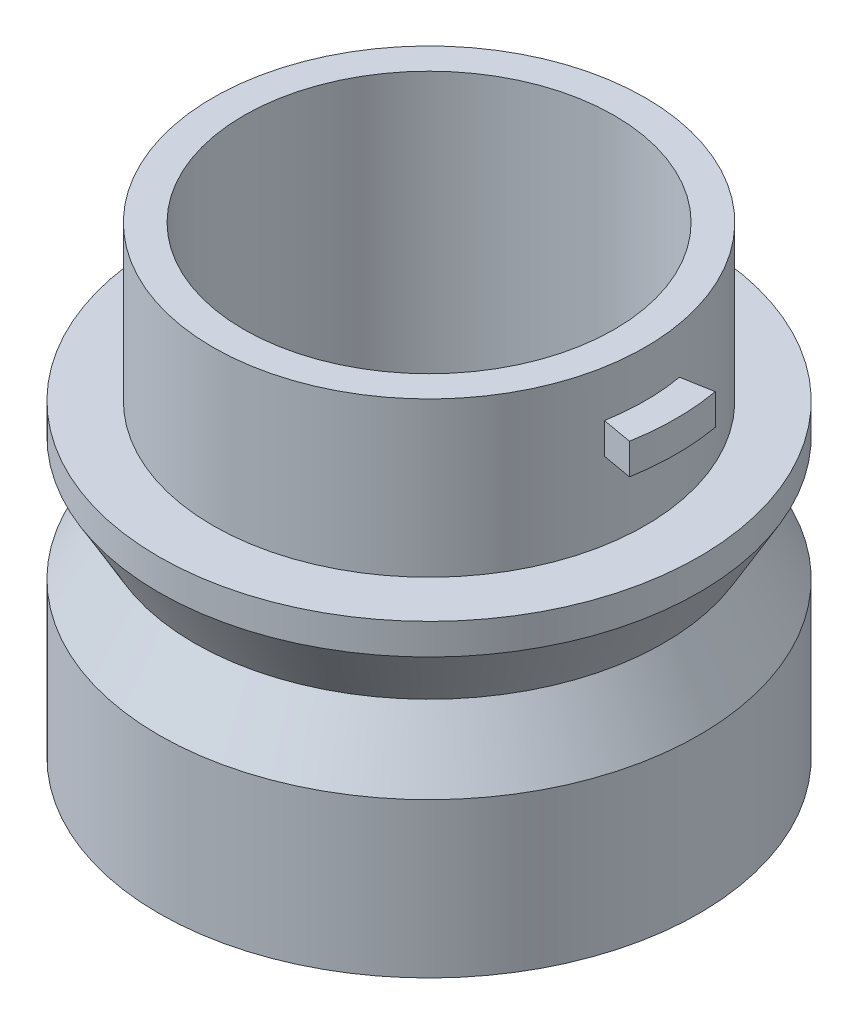
from build123d import *

# Parameters (mm, degrees)
SKETCH2_W          = 2
SKETCH2_H          = 2
REVOLVE2_ANGLE     = 20
SKETCH3_W          = 2.2
SKETCH3_H          = 6.8
CUT_REVOLVE1_ANGLE = 25
SKETCH4_W          = 4.7
SKETCH4_H          = 2.5
CUT_REVOLVE2_ANGLE = 45


with BuildPart() as part:
    # Sketch1 → Revolve1 (revolve)
    with BuildSketch(Plane.XY, mode=Mode.PRIVATE) as revolve1_sk:
        Polygon((12, 15), (12, -5), (14.5, -5), (14.5, -15), (17.5, -15), (17.5, -5), (15.190598923, -1), (17.5, 3), (17.5, 5), (14, 5), (14, 15), align=None)
    revolve(revolve1_sk.sketch.rotate(Axis((0, 40.467735012, 0), (0, -1, 0)), 90), axis=Axis((0, 40.467735012, 0), (0, -1, 0)))

    # Sketch2 → Revolve2 (revolve, symmetric)
    with BuildSketch(Plane.XY) as revolve2_sk:
        with Locations((15, 11)):
            Rectangle(SKETCH2_W, SKETCH2_H)
        with Locations((-15, 11)):
            Rectangle(SKETCH2_W, SKETCH2_H)
    revolve(axis=Axis((0, 45.306661743, 0), (0, -1, 0)), revolution_arc=REVOLVE2_ANGLE / 2)
    revolve(revolve2_sk.sketch, axis=Axis((0, 45.306661743, 0), (0, 1, 0)), revolution_arc=REVOLVE2_ANGLE / 2)

    # Sketch3 → Cut-Revolve1 (revolve, symmetric, cut)
    with BuildSketch(Plane.XY) as cut_revolve1_sk:
        with Locations((-15.6, -11.6)):
            Rectangle(SKETCH3_W, SKETCH3_H)
        with Locations((15.6, -11.6)):
            Rectangle(SKETCH3_W, SKETCH3_H)
    revolve(axis=Axis((0, -11.020729768, 0), (0, -1, 0)), revolution_arc=CUT_REVOLVE1_ANGLE / 2, mode=Mode.SUBTRACT)
    revolve(cut_revolve1_sk.sketch, axis=Axis((0, -11.020729768, 0), (0, 1, 0)), revolution_arc=CUT_REVOLVE1_ANGLE / 2, mode=Mode.SUBTRACT)

    # Sketch4 → Cut-Revolve2 (revolve, cut)
    with BuildSketch(Plane.XY):
        with Locations((-14.35, -9.45)):
            Rectangle(SKETCH4_W, SKETCH4_H)
        with Locations((14.35, -9.45)):
            Rectangle(SKETCH4_W, SKETCH4_H)
    revolve(axis=Axis((0, -42.004114959, 0), (0, 1, 0)), revolution_arc=CUT_REVOLVE2_ANGLE, mode=Mode.SUBTRACT)


solid = part.part
